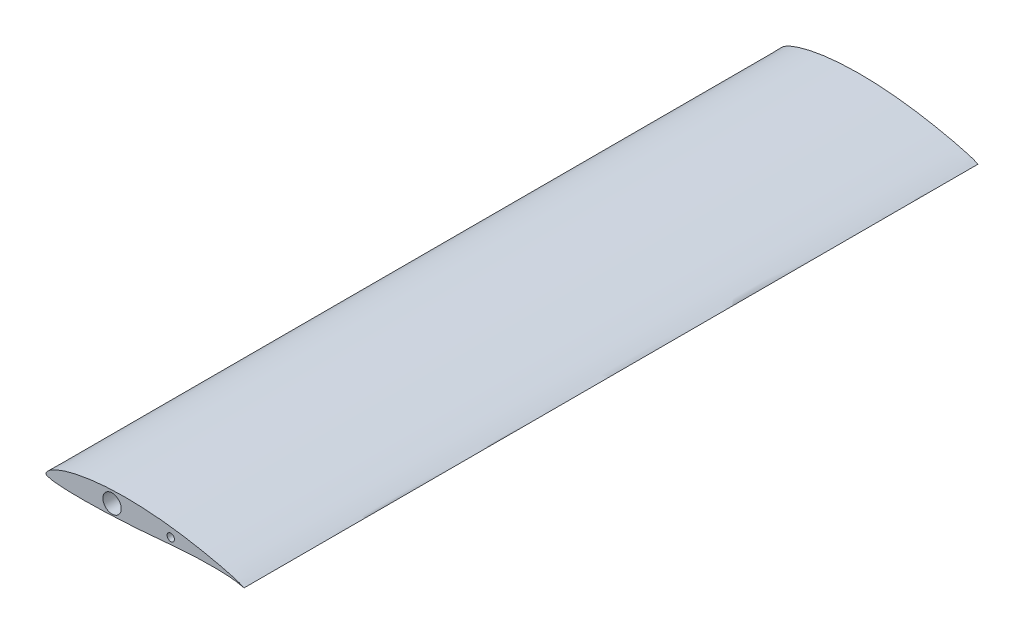
from build123d import *

# Parameters (mm, degrees)
BOSS_EXTRUDE1_DEPTH = 1000
SKETCH1_3_R         = 12.5
SKETCH1_3_R_2       = 5
CUT_EXTRUDE1_DEPTH  = 1037.135587203


with BuildPart() as part:
    # Sketch1 → Boss-Extrude1 (new body)
    with BuildSketch(Plane.XY):
        with BuildLine():
            add(Edge.make_bspline(
                [(270, 0), (269.997712349, 0.023468661), (268.237544941, 0.666521839), (266.567167257, 1.466789664), (262.675565235, 3.01541236), (257.913204906, 4.572419994), (251.732046911, 6.332511181), (244.411227292, 8.237575471), (235.957624235, 10.272814456), (226.514158982, 12.38933885), (216.193353243, 14.540861966), (205.131334675, 16.677544685), (193.456704412, 18.7297696), (181.297741573, 20.632447569), (168.767775932, 22.311665368), (155.975282971, 23.707924082), (143.035274217, 24.804856211), (130.06168369, 25.580194161), (117.173431648, 26.000287002), (104.483656181, 26.057596154), (92.104375501, 25.753147531), (80.139477401, 25.074235193), (68.690037108, 24.038074266), (57.850888144, 22.669913071), (47.714343715, 21.012498661), (38.37316885, 19.087217341), (29.908423923, 16.955757767), (22.398973416, 14.644399999), (15.90790334, 12.21589514), (10.484326099, 9.720163832), (6.177015703, 7.220860756), (2.961164208, 4.741201423), (0.976626841, 2.42611563), (0.023704484, 0.790715424), (-0.016204009, -0.46972147), (0.800260735, -1.836070967), (3.492141103, -2.629537712), (7.307971652, -3.662676489), (12.656595645, -4.399117434), (19.319388615, -5.032889423), (27.290506862, -5.469798203), (36.462169983, -5.738674764), (46.741441235, -5.840005255), (58.010459053, -5.770159701), (70.143350573, -5.536829539), (83.007144053, -5.1408123), (96.462851164, -4.565906732), (110.373983662, -3.827009828), (124.616655035, -2.892998567), (139.099460234, -1.736345581), (153.734791934, -0.400812923), (168.409733753, 0.892284934), (182.93390361, 2.041435072), (197.07817006, 2.959215034), (210.604377411, 3.579037035), (223.266715876, 3.874376135), (234.84053921, 3.81861077), (245.04773169, 3.453293105), (253.778580241, 2.76286494), (260.440654454, 1.942229627), (265.781454332, 0.929874857), (267.932950881, 0.533749209), (270.002416438, -0.024789873), (270, 0)],
                knots=[0, 0, 0, 0, 0.001693524, 0.006395447, 0.013461651, 0.022753575, 0.034367307, 0.048191023, 0.064031392, 0.081680617, 0.100894124, 0.121431794, 0.143025453, 0.165434011, 0.188439039, 0.211855124, 0.235496289, 0.259143745, 0.282614908, 0.305701545, 0.328231584, 0.350030434, 0.370943883, 0.390816529, 0.409505873, 0.42685655, 0.442733385, 0.457018388, 0.46961507, 0.480449695, 0.48947186, 0.496730301, 0.502329147, 0.50625566, 0.506441945, 0.509181516, 0.513913846, 0.521178419, 0.530944157, 0.543144509, 0.557669674, 0.574383526, 0.593109554, 0.613638212, 0.635743557, 0.659184095, 0.683713689, 0.709075754, 0.735036066, 0.761429739, 0.788183766, 0.81505683, 0.841644764, 0.86751356, 0.892232409, 0.915363656, 0.936485325, 0.955199832, 0.971104187, 0.983751026, 0.992812818, 0.998211136, 1, 1, 1, 1], degree=3))
        make_face()
    extrude(amount=BOSS_EXTRUDE1_DEPTH)

    # Sketch1<3> → Cut-Extrude1 (cut, through all)
    with BuildSketch(Plane.XY):
        with Locations((90, 9.603267329)):
            Circle(SKETCH1_3_R)
        with Locations((170, 9.603267329)):
            Circle(SKETCH1_3_R_2)
    extrude(amount=CUT_EXTRUDE1_DEPTH, mode=Mode.SUBTRACT)


solid = part.part
